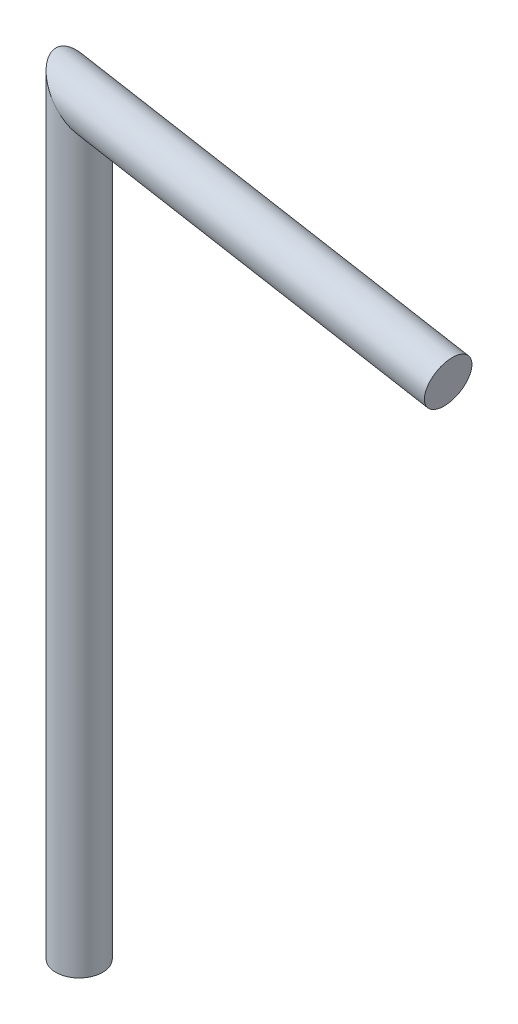
from build123d import *

# Parameters (mm, degrees)
SKETCH_5_R = 2.5


with BuildPart() as part:
    # 扫描1: sweep along a path in 草图6
    with BuildLine(Plane.XY) as sweep_1_path:
        Line((0, 0), (0, 80))
        Line((0, 80), (39.39231012, 73.054072893))
    # 草图5 → 扫描1 (sweep)
    with BuildSketch(Plane(origin=(0, 0, 0), x_dir=(1, 0, 0), z_dir=(0, 1, 0))):
        Circle(SKETCH_5_R)
    sweep(path=sweep_1_path.line, transition=Transition.RIGHT)


solid = part.part
